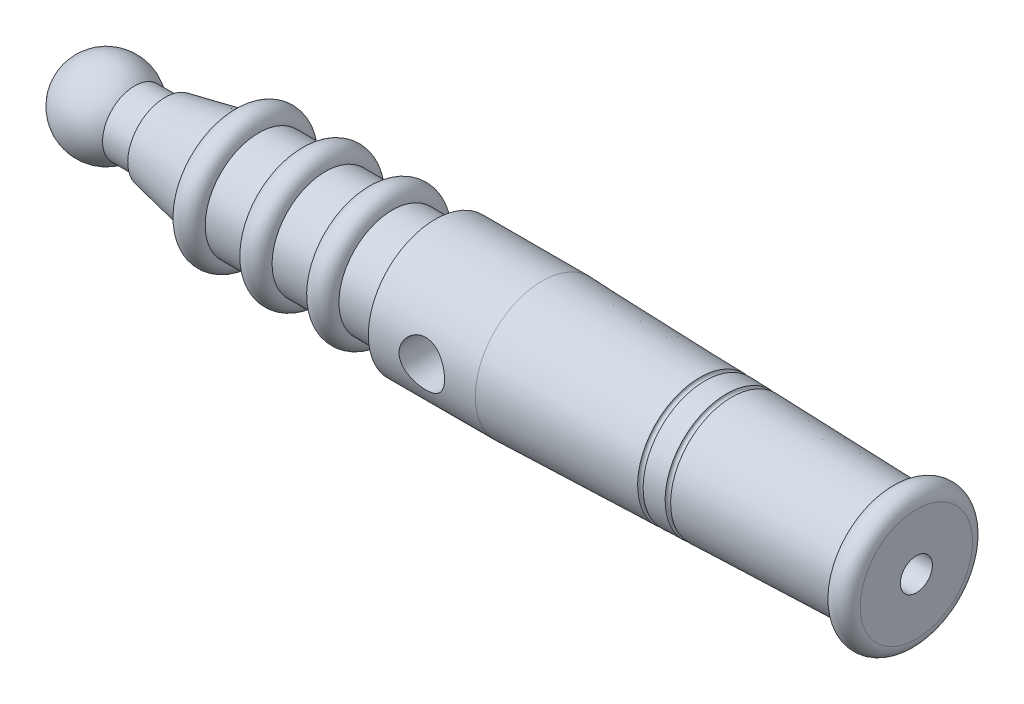
from build123d import *

# Parameters (mm, degrees)
CUT_EXTRUDE7_DEPTH      = 161.554975497
CUT_EXTRUDE7_DEPTH_BACK = 161.554975497
SKETCH3_R               = 4.25


with BuildPart() as part:
    # Sketch2 → Revolve1 (revolve)
    with BuildSketch(Plane.XY, mode=Mode.PRIVATE) as revolve1_sk:
        with BuildLine():
            Line((0, 0), (109.498903293, 0))
            Line((109.498903293, 0), (109.498903293, 3))
            Line((109.498903293, 3), (159.498903293, 3))
            Line((159.498903293, 3), (159.498903293, 10.5))
            ThreePointArc((159.498903293, 10.5), (157.035928745, 12.999725808), (154.5, 10.574042782))
            Line((154.5, 10.574042782), (124.984203858, 11.448599099))
            ThreePointArc((124.984203858, 11.448599099), (124.469395302, 10.948818441), (123.985081032, 11.47820322))
            Line((123.985081032, 11.47820322), (119.986397273, 11.596684663))
            ThreePointArc((119.986397273, 11.596684663), (119.471588716, 11.096904005), (118.987274446, 11.626288784))
            Line((118.987274446, 11.626288784), (89.5, 12.5))
            Line((89.5, 12.5), (69.5, 12.5))
            Line((69.5, 12.5), (69.5, 10))
            Line((69.5, 10), (61.5, 10))
            ThreePointArc((61.5, 10), (59, 12.5), (56.5, 10))
            Line((56.5, 10), (49.032925475, 10))
            Line((49.032925475, 10), (49, 10))
            ThreePointArc((49, 10), (46.5, 12.5), (44, 10))
            Line((44, 10), (36.5, 10))
            ThreePointArc((36.5, 10), (33.753655955, 12.487833317), (31.548548311, 9.509709662))
            Line((31.548548311, 9.509709662), (19, 7))
            Line((19, 7), (19, 6))
            Line((19, 6), (13.291502622, 6))
            ThreePointArc((13.291502622, 6), (4.708497378, 7.291502622), (0, 0))
        make_face()
    revolve(revolve1_sk.sketch.rotate(Axis((0, 0, 0), (1, 0, 0)), 180), axis=Axis((0, 0, 0), (1, 0, 0)))

    # Sketch3 → Cut-Extrude7 (cut, two sides: drawn at the far end of the back side and taken through both)
    with BuildSketch(Plane.XY.offset(-CUT_EXTRUDE7_DEPTH_BACK)):
        with Locations((79.5, 0)):
            Circle(SKETCH3_R)
    extrude(amount=CUT_EXTRUDE7_DEPTH + CUT_EXTRUDE7_DEPTH_BACK, mode=Mode.SUBTRACT)


solid = part.part
